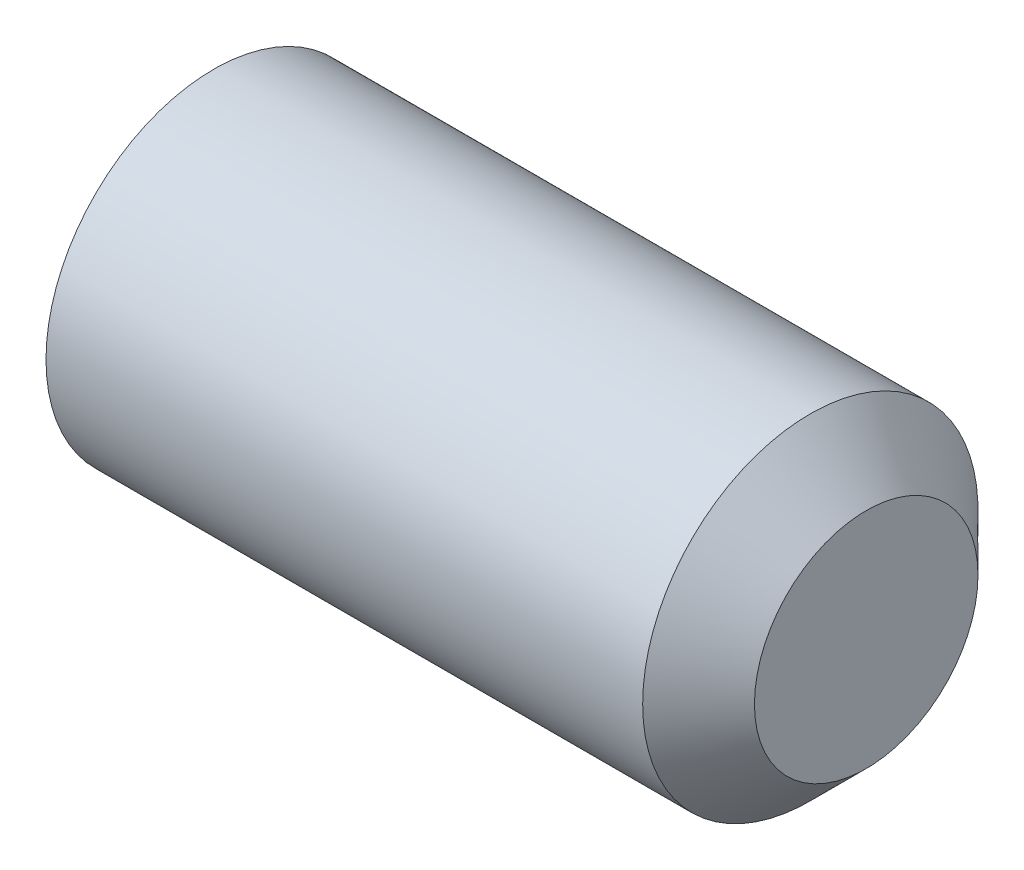
from build123d import *

# Parameters (mm, degrees)
HEX_2_DEPTH = 2


with BuildPart() as part:
    # BodySke → BaseBody (revolve)
    with BuildSketch(Plane.XY, mode=Mode.PRIVATE) as basebody_sk:
        Polygon((0, 0), (0, 1.2195), (0.161946751, 1.5), (5.5, 1.5), (6, 1), (6, 0), align=None)
    revolve(basebody_sk.sketch.rotate(Axis((-12.7, 0, 0), (1, 0, 0)), 90), axis=Axis((-12.7, 0, 0), (1, 0, 0)))

    # Sketch2 → Hex 2 (cut)
    with BuildSketch(Plane.ZY):
        Polygon((0.433012702, 0.75), (-0.433012702, 0.75), (-0.866025404, 0), (-0.433012702, -0.75), (0.433012702, -0.75), (0.866025404, 0), align=None)
    extrude(amount=-HEX_2_DEPTH, mode=Mode.SUBTRACT)


solid = part.part
